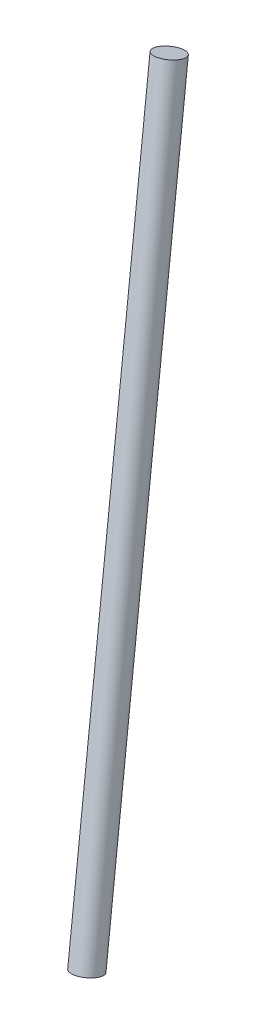
from build123d import *

# Parameters (mm, degrees)
SWEEP1_PROFILE_R = 7.5


with BuildPart() as part:
    # Sweep1: sweep along a curve in space
    with BuildLine() as sweep1_path:
        Line((4029.556876596, 695.574480357, 309.218380298), (4074.02951192, 324.168369142, 399.146471618))
    # Sweep1 profile (on start of the path) → Sweep1 (sweep)
    with BuildSketch(Plane(origin=(4029.556876596, 695.574480357, 309.218380298), x_dir=(0, -0.2353287488961019, -0.9719158296596447), z_dir=(0.11559823022284549, -0.9654001575782881, 0.23375111746719526))):
        Circle(SWEEP1_PROFILE_R)
    sweep(path=sweep1_path.line)


solid = part.part
